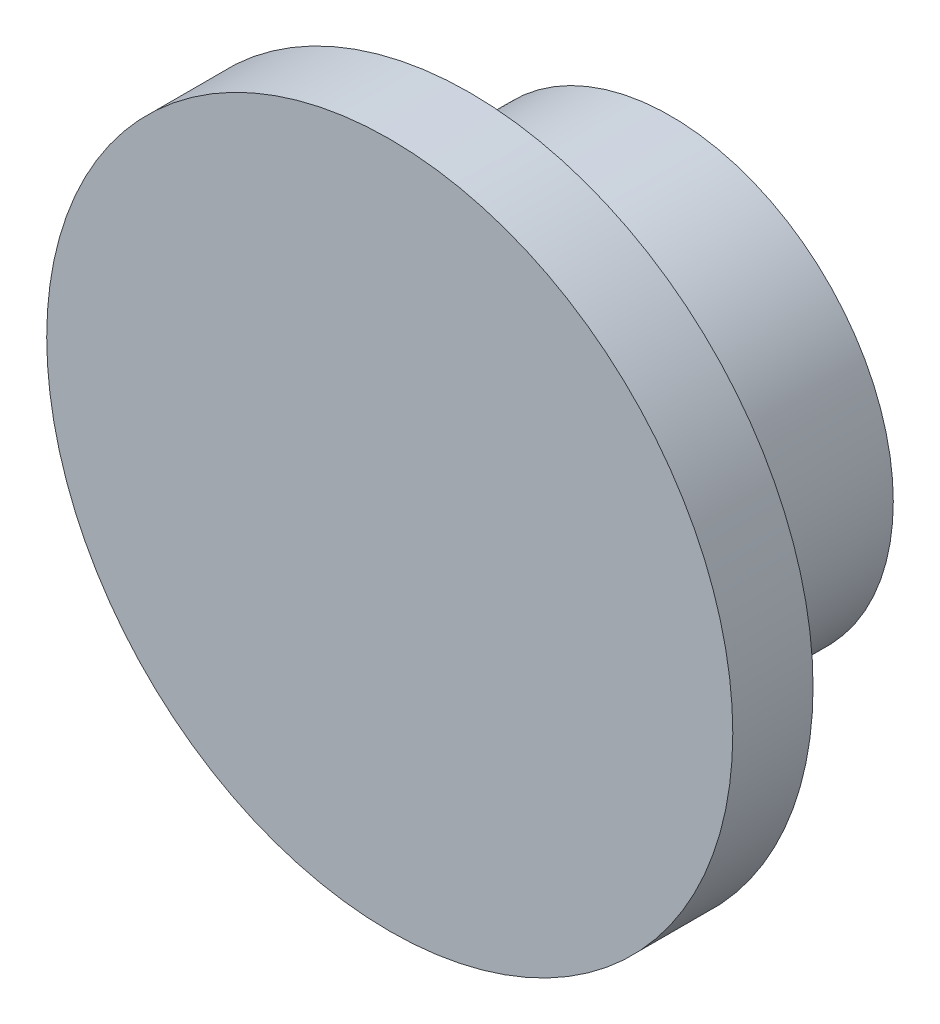
from build123d import *

# Parameters (mm, degrees)
SKETCH1_R           = 5.55
SKETCH1_R_2         = 2.55
BOSS_EXTRUDE1_DEPTH = 5
SKETCH2_R           = 8.55
BOSS_EXTRUDE2_DEPTH = 2


with BuildPart() as part:
    # Sketch1 → Boss-Extrude1 (new body)
    with BuildSketch(Plane.XY):
        Circle(SKETCH1_R)
        Circle(SKETCH1_R_2, mode=Mode.SUBTRACT)
    extrude(amount=-BOSS_EXTRUDE1_DEPTH)

    # Sketch2 → Boss-Extrude2 (add)
    with BuildSketch(Plane.XY):
        Circle(SKETCH2_R)
    extrude(amount=BOSS_EXTRUDE2_DEPTH)


solid = part.part
